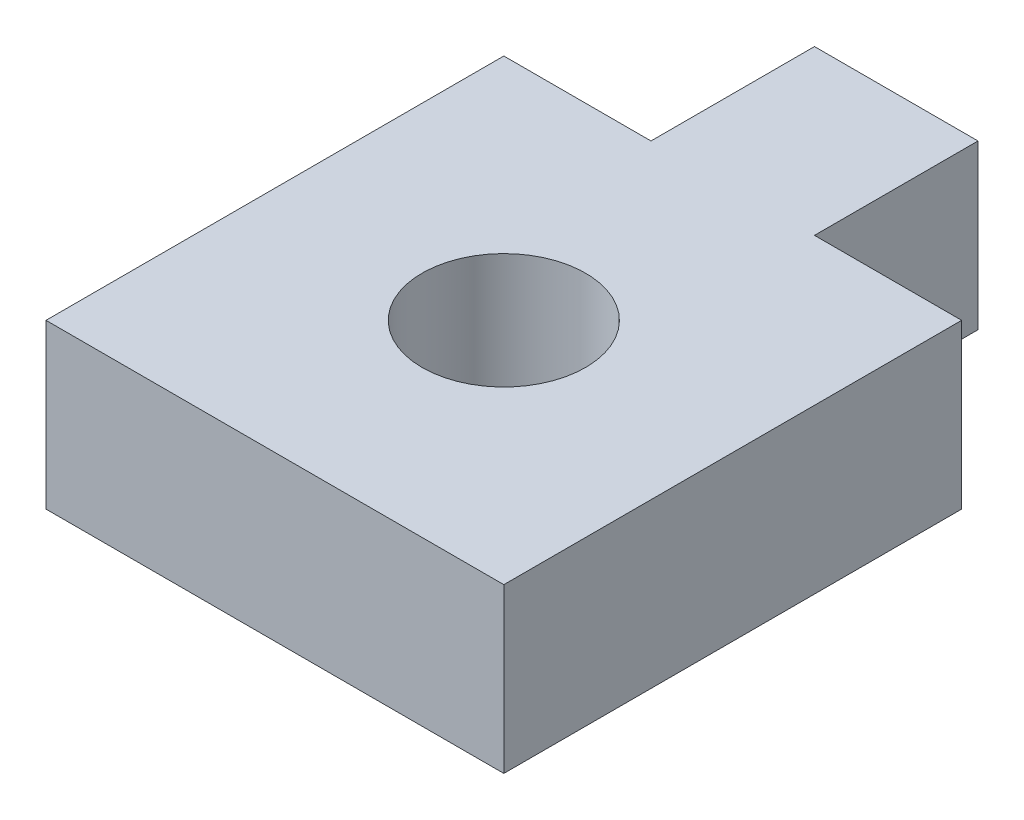
from build123d import *

# Parameters (mm, degrees)
SKETCH1_R           = 3.175
BOSS_EXTRUDE1_DEPTH = 6.35


with BuildPart() as part:
    # Sketch1 → Boss-Extrude1 (new body)
    with BuildSketch(Plane(origin=(0, 0, 0), x_dir=(1, 0, 0), z_dir=(0, 1, 0))):
        Polygon((0, 0), (0, 17.78), (-5.715, 17.78), (-5.715, 24.13), (-12.065, 24.13), (-12.065, 17.78), (-17.78, 17.78), (-17.78, 0), align=None)
        with Locations(Location((-8.89, 8.89, 0), (0, 0, 270))):
            Circle(SKETCH1_R, mode=Mode.SUBTRACT)
    extrude(amount=BOSS_EXTRUDE1_DEPTH)


solid = part.part
